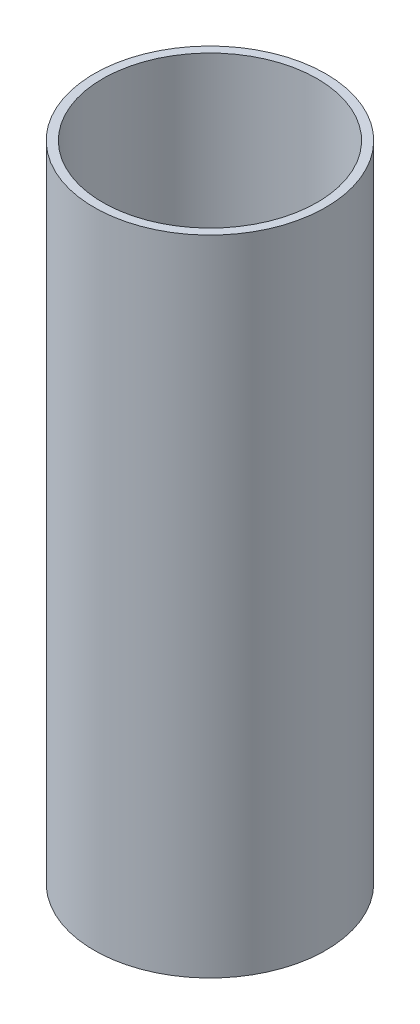
from build123d import *

# Parameters (mm, degrees)
SKETCH2_R           = 13.716
SKETCH2_R_2         = 12.7
BOSS_EXTRUDE1_DEPTH = 76.2


with BuildPart() as part:
    # Sketch2 → Boss-Extrude1 (new body)
    with BuildSketch(Plane(origin=(0, 0, 0), x_dir=(1, 0, 0), z_dir=(0, 1, 0))):
        with Locations(Location((0, 0, 0), (0, 0, 90))):
            Circle(SKETCH2_R)
        with Locations(Location((0, 0, 0), (0, 0, 90))):
            Circle(SKETCH2_R_2, mode=Mode.SUBTRACT)
    extrude(amount=BOSS_EXTRUDE1_DEPTH)


solid = part.part
